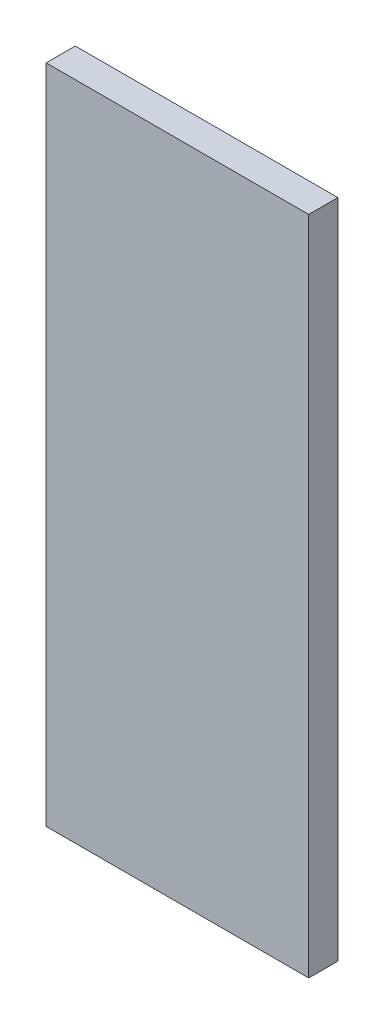
from build123d import *

# Parameters (mm, degrees)
SKETCH1_W           = 685.8
SKETCH1_H           = 1727.2
BOSS_EXTRUDE1_DEPTH = 76.2


with BuildPart() as part:
    # Sketch1 → Boss-Extrude1 (new body)
    with BuildSketch(Plane.XY):
        Rectangle(SKETCH1_W, SKETCH1_H)
    extrude(amount=BOSS_EXTRUDE1_DEPTH)


solid = part.part
